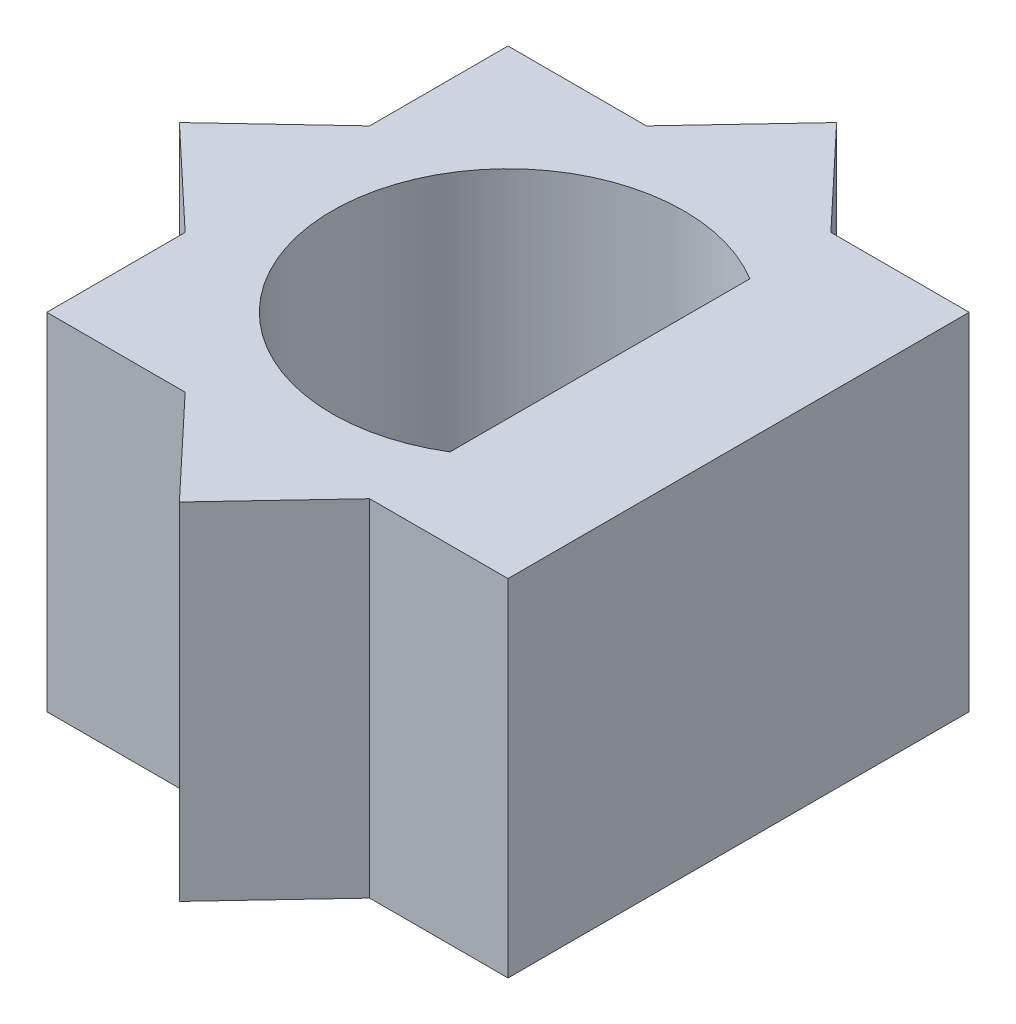
from build123d import *

# Parameters (mm, degrees)
ESQUISSE1_W        = 8
ESQUISSE1_H        = 8
ESQUISSE1_R        = 3.05
BOSS_EXTRU_1_DEPTH = 6


with BuildPart() as part:
    # Esquisse1 → Boss.-Extru.1 (new body)
    # profile 1 of 6: a face of its own
    with BuildSketch(Plane(origin=(0, 0, 0), x_dir=(1, 0, 0), z_dir=(0, 1, 0))):
        Rectangle(ESQUISSE1_W, ESQUISSE1_H)
        Circle(ESQUISSE1_R, mode=Mode.SUBTRACT)
    # profile 2 of 6: a face of its own
    with BuildSketch(Plane(origin=(0, 0, 0), x_dir=(1, 0, 0), z_dir=(0, 1, 0))):
        Polygon((1.6, -4), (-1.6, -4), (0, -5.7), align=None)
    # profile 3 of 6: a face of its own
    with BuildSketch(Plane(origin=(0, 0, 0), x_dir=(1, 0, 0), z_dir=(0, 1, 0))):
        Polygon((-1.6, 4), (-4, 4), (-4, 1.6), (-4, -1.6), (-4, -4), (-1.6, -4), (1.6, -4), (4, -4), (4, 4), (1.6, 4), align=None)
        with BuildLine():
            ThreePointArc((1.594521872, -2.6), (-3.05, 0), (1.594521872, 2.6))
            ThreePointArc((1.594521872, 2.6), (2.661371048, 1.489833597), (3.05, 0))
            ThreePointArc((3.05, 0), (2.661371048, -1.489833597), (1.594521872, -2.6))
        make_face(mode=Mode.SUBTRACT)
    # profile 4 of 6: a face of its own
    with BuildSketch(Plane(origin=(0, 0, 0), x_dir=(1, 0, 0), z_dir=(0, 1, 0))):
        with BuildLine():
            ThreePointArc((3.05, 0), (2.661371048, 1.489833597), (1.594521872, 2.6))
            Line((1.594521872, 2.6), (1.594521872, -2.6))
            ThreePointArc((1.594521872, -2.6), (2.661371048, -1.489833597), (3.05, 0))
        make_face()
    # profile 5 of 6: a face of its own
    with BuildSketch(Plane(origin=(0, 0, 0), x_dir=(1, 0, 0), z_dir=(0, 1, 0))):
        Polygon((-4, -1.6), (-4, 1.6), (-5.7, 0), align=None)
    # profile 6 of 6: a face of its own
    with BuildSketch(Plane(origin=(0, 0, 0), x_dir=(1, 0, 0), z_dir=(0, 1, 0))):
        Polygon((0, 5.7), (-1.6, 4), (1.6, 4), align=None)
    extrude(amount=BOSS_EXTRU_1_DEPTH)


solid = part.part
